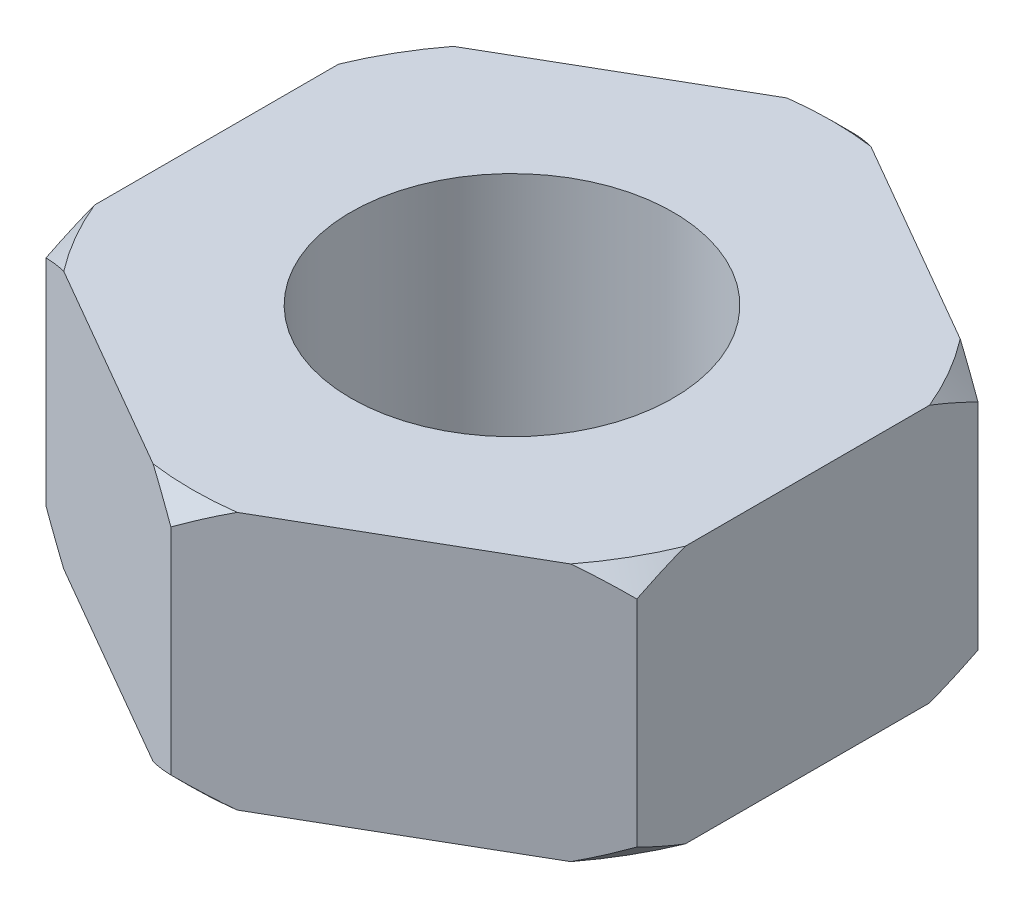
from build123d import *

# Parameters (mm, degrees)
SKETCH1_R           = 1.5
BOSS_EXTRUDE1_DEPTH = 2.4


with BuildPart() as part:
    # Sketch1 → Boss-Extrude1 (new body)
    with BuildSketch(Plane(origin=(0, 0, 0), x_dir=(1, 0, 0), z_dir=(0, 1, 0))):
        Polygon((0, 3.175426481), (-2.75, 1.58771324), (-2.75, -1.58771324), (0, -3.175426481), (2.75, -1.58771324), (2.75, 1.58771324), align=None)
        with Locations(Location((0, 0, 0), (0, 0, 270))):
            Circle(SKETCH1_R, mode=Mode.SUBTRACT)
    extrude(amount=BOSS_EXTRUDE1_DEPTH)

    # Sketch3 → Cut-Revolve3 (revolve, cut)
    with BuildSketch(Plane(origin=(0, 0, 0), x_dir=(0, 0, -1), z_dir=(1, 0, 0))):
        Polygon((2.975426481, 2.4), (3.175426481, 2.4), (3.175426481, 2.2), align=None)
        Polygon((3.175426481, 0), (2.975426481, 0), (3.175426481, 0.2), align=None)
    revolve(axis=Axis((0, 0, 0), (0, 1, 0)), mode=Mode.SUBTRACT)


solid = part.part
